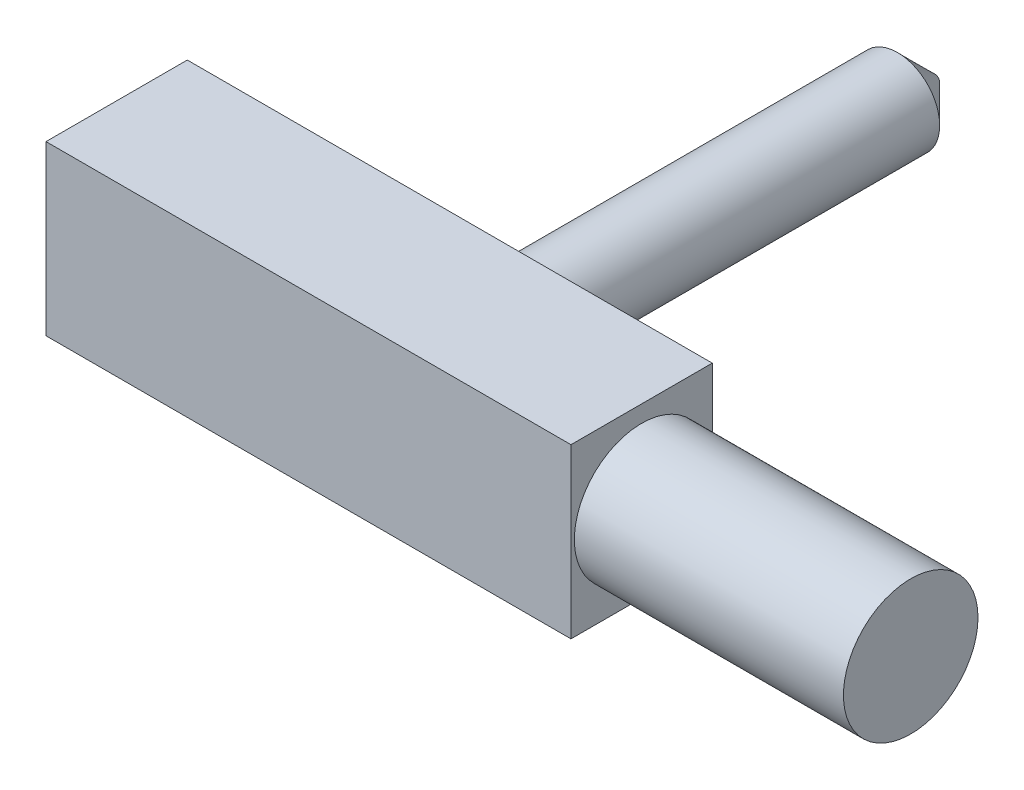
from build123d import *

# Parameters (mm, degrees)
SKETCH1_W           = 78.03
SKETCH1_H           = 25
BOSS_EXTRUDE1_DEPTH = 21
SKETCH2_R           = 10
BOSS_EXTRUDE2_DEPTH = 40
SKETCH4_R           = 6.25
BOSS_EXTRUDE3_DEPTH = 65.56
CHAMFER1_SIZE       = 5.56


with BuildPart() as part:
    # Sketch1 → Boss-Extrude1 (new body)
    with BuildSketch(Plane.XY):
        Rectangle(SKETCH1_W, SKETCH1_H)
    extrude(amount=-BOSS_EXTRUDE1_DEPTH)

    # Sketch2 → Boss-Extrude2 (add)
    with BuildSketch(Plane(origin=(39.015, 0, 0), x_dir=(0, 0, -1), z_dir=(1, 0, 0))):
        with Locations((10.5, 0)):
            Circle(SKETCH2_R)
    extrude(amount=BOSS_EXTRUDE2_DEPTH)

    # Sketch4 → Boss-Extrude3 (add)
    with BuildSketch(Plane(origin=(0, 0, -21), x_dir=(-1, 0, 0), z_dir=(0, 0, -1))):
        with Locations((-6.565, 0)):
            Circle(SKETCH4_R)
    extrude(amount=BOSS_EXTRUDE3_DEPTH)

    # Chamfer1
    chamfer1_edges = [part.edges().sort_by_distance(p)[0] for p in [
        (12.815, 0, -86.56),
    ]]
    chamfer(chamfer1_edges, length=CHAMFER1_SIZE)


solid = part.part
